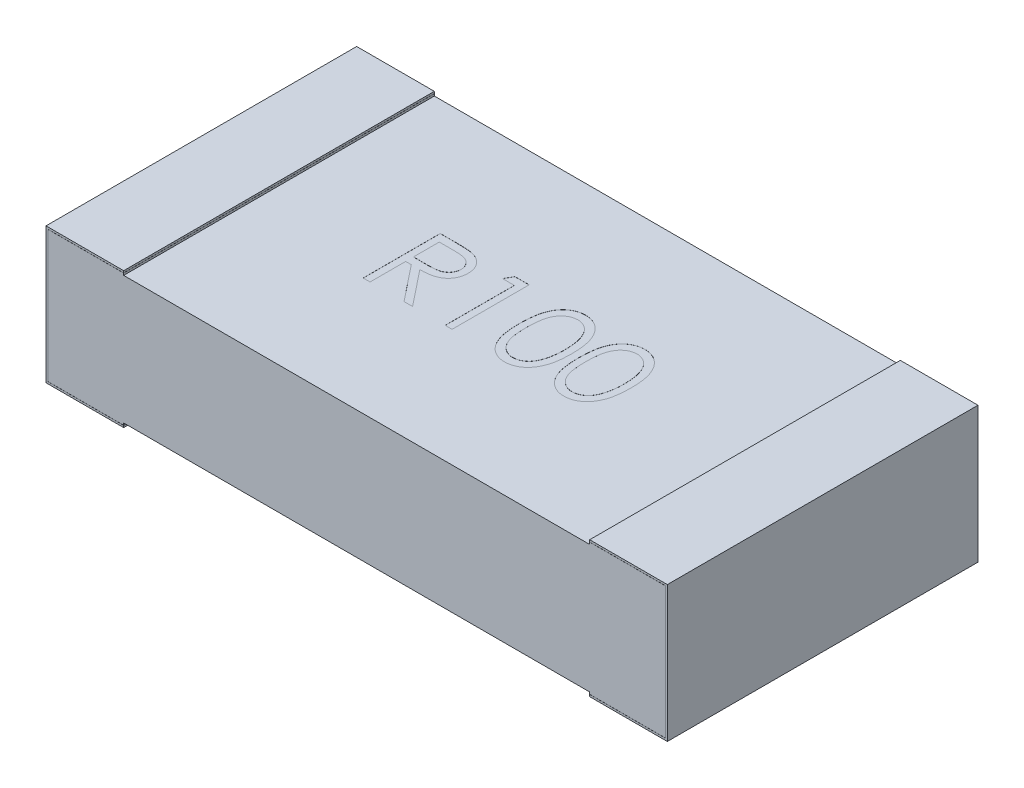
from build123d import *

# Parameters (mm, degrees)
SKETCH1_W           = 6.4
SKETCH1_H           = 3.2
BOSS_EXTRUDE1_DEPTH = 1.4
SKETCH2_W           = 4.8
SKETCH2_H           = 0.042
CUT_EXTRUDE1_DEPTH  = 8.291090453
CUT_EXTRUDE2_DEPTH  = 8.291090453
CUT_EXTRUDE3_DEPTH  = 0.001


with BuildPart() as part:
    # Sketch1 → Boss-Extrude1 (new body)
    with BuildSketch(Plane(origin=(0, 0, 0), x_dir=(1, 0, 0), z_dir=(0, 1, 0))):
        with Locations((3.2, 1.6)):
            Rectangle(SKETCH1_W, SKETCH1_H)
    extrude(amount=BOSS_EXTRUDE1_DEPTH)

    # Sketch2 → Cut-Extrude1 (cut, through all)
    with BuildSketch(Plane.XY):
        with Locations((3.2, 1.379)):
            Rectangle(SKETCH2_W, SKETCH2_H)
        with Locations((3.2, 0.021)):
            Rectangle(SKETCH2_W, SKETCH2_H)
    extrude(amount=-CUT_EXTRUDE1_DEPTH, mode=Mode.SUBTRACT)

    # Sketch5 → Cut-Extrude2 (cut, through all)
    with BuildSketch(Plane.XY):
        Polygon((0.02, 0.02), (0.8, 0.02), (0.8, 0.021), (0.021, 0.021), (0.021, 1.379), (0.8, 1.379), (0.8, 1.38), (0.02, 1.38), align=None)
        Polygon((6.379, 0.021), (5.6, 0.021), (5.6, 0.02), (6.38, 0.02), (6.38, 1.38), (5.6, 1.38), (5.6, 1.379), (6.379, 1.379), align=None)
    extrude(amount=-CUT_EXTRUDE2_DEPTH, mode=Mode.SUBTRACT)


with BuildPart() as cut_extrude2_piece_1:
    # of the separate pieces the step leaves, piece 1, a body of its own (cut_extrude2_pieces)
    add(part.part.solids().sort_by_distance((0.8, 0.042, 0))[0])

    # Sketch6 → Cut-Extrude3 (cut)
    # profile 1 of 4: a face of its own
    with BuildSketch(Plane(origin=(0, 1.358, 0), x_dir=(1, 0, 0), z_dir=(0, 1, 0))):
        with BuildLine():
            Line((2.056591687, 2.004217854), (2.21543709, 2.004217854))
            add(Edge.make_bspline(
                [(2.21543709, 2.004217854), (2.22603731, 2.004182569), (2.246390907, 2.004114819), (2.275549488, 2.003737048), (2.302044205, 2.002654292), (2.325861204, 2.001722524), (2.347000049, 2.000023459), (2.36552556, 1.998399526), (2.381352413, 1.996273714), (2.390933168, 1.994299448), (2.395271074, 1.993405554)],
                knots=[0, 0, 0, 0, 1.410062039, 2.707475311, 3.878576406, 4.937260626, 5.877586885, 6.699081471, 7.410979367, 8, 8, 8, 8], degree=3))
            add(Edge.make_bspline(
                [(2.395271074, 1.993405554), (2.401078291, 1.991970734), (2.41256884, 1.989131703), (2.429112873, 1.983131044), (2.444877729, 1.97618695), (2.459797921, 1.968030892), (2.473798717, 1.958602326), (2.487024476, 1.94806402), (2.499535215, 1.936473635), (2.510824978, 1.923538948), (2.521470084, 1.909968883), (2.530448219, 1.895294995), (2.538187617, 1.879950327), (2.544349502, 1.863778823), (2.549311114, 1.846937314), (2.552809565, 1.829273248), (2.554907602, 1.810867098), (2.555121202, 1.798312715), (2.555229508, 1.791946971)],
                knots=[0, 0, 0, 0, 1.027469482, 2.033020251, 3.019912614, 3.986113645, 4.951240523, 5.91722682, 6.890402269, 7.87763091, 8.8651537, 9.85103654, 10.82876324, 11.815024772, 12.821070561, 13.842952187, 14.906261191, 16, 16, 16, 16], degree=3))
            add(Edge.make_bspline(
                [(2.555229508, 1.791946971), (2.55489636, 1.781370795), (2.554246303, 1.760733937), (2.548185431, 1.730784416), (2.538257542, 1.702846839), (2.524577081, 1.676956384), (2.507155522, 1.65361772), (2.486217578, 1.633118456), (2.46175157, 1.615964404), (2.438975635, 1.604068857), (2.418856522, 1.596450466), (2.40229361, 1.591090077), (2.384226278, 1.586948524), (2.364827632, 1.58323828), (2.344016946, 1.580437092), (2.321844098, 1.578385454), (2.298293274, 1.577103196), (2.282114593, 1.576912242), (2.273791707, 1.576814008)],
                knots=[0, 0, 0, 0, 1.260483769, 2.459530307, 3.627416485, 4.787058657, 5.939039949, 7.08810263, 8.267026773, 9.491475466, 10.141966685, 10.831826277, 11.566392101, 12.351337768, 13.187381173, 14.07005841, 15.007169909, 16, 16, 16, 16], degree=3))
            Line((2.273791707, 1.576814008), (2.56540579, 1.210467854))
            Line((2.56540579, 1.210467854), (2.477317348, 1.210467854))
            Line((2.477317348, 1.210467854), (2.185703266, 1.576814008))
            Line((2.185703266, 1.576814008), (2.127825662, 1.576814008))
            Line((2.127825662, 1.576814008), (2.127825662, 1.210467854))
            Line((2.127825662, 1.210467854), (2.056591687, 1.210467854))
            Line((2.056591687, 1.210467854), (2.056591687, 2.004217854))
        make_face()
        with BuildLine():
            Line((2.127825662, 1.922807598), (2.127825662, 1.658224264))
            Line((2.127825662, 1.658224264), (2.27315569, 1.657111233))
            add(Edge.make_bspline(
                [(2.27315569, 1.657111233), (2.279941127, 1.657108232), (2.293093238, 1.657102413), (2.31212071, 1.658008145), (2.329837235, 1.659038504), (2.346175048, 1.660614516), (2.361141449, 1.662645626), (2.374728955, 1.665186302), (2.386959747, 1.668146324), (2.401224237, 1.672727764), (2.417152879, 1.679986272), (2.434463763, 1.690546661), (2.449205365, 1.703829301), (2.461659952, 1.719017924), (2.471667876, 1.735717573), (2.478723646, 1.753728071), (2.48320095, 1.772594737), (2.483729031, 1.785561915), (2.483995534, 1.792105975)],
                knots=[0, 0, 0, 0, 1.146690395, 2.22261258, 3.21895312, 4.145990853, 4.996080663, 5.770904154, 6.481378293, 7.121626537, 8.300444488, 9.431385265, 10.535395872, 11.636531494, 12.74115979, 13.810798291, 14.895190096, 16, 16, 16, 16], degree=3))
            add(Edge.make_bspline(
                [(2.483995534, 1.792105975), (2.48372291, 1.798489216), (2.483182669, 1.81113847), (2.478771966, 1.829656864), (2.471313124, 1.847134547), (2.461261474, 1.863500422), (2.449015237, 1.878356187), (2.434655661, 1.89106688), (2.418575376, 1.901555598), (2.403546015, 1.908258109), (2.390112542, 1.912367433), (2.378449029, 1.915259215), (2.365270176, 1.917582514), (2.350511992, 1.919443985), (2.334237479, 1.921043946), (2.31636435, 1.922121581), (2.297011187, 1.922759726), (2.283597508, 1.922791269), (2.276653787, 1.922807598)],
                knots=[0, 0, 0, 0, 1.101028733, 2.181837193, 3.264309656, 4.369019818, 5.486613113, 6.575447106, 7.666700264, 8.788928104, 9.402425223, 10.0903467, 10.862060571, 11.710948788, 12.657782767, 13.684531032, 14.801375019, 16, 16, 16, 16], degree=3))
            Line((2.276653787, 1.922807598), (2.127825662, 1.922807598))
        make_face(mode=Mode.SUBTRACT)
    # profile 2 of 4: a face of its own
    with BuildSketch(Plane(origin=(0, 1.358, 0), x_dir=(1, 0, 0), z_dir=(0, 1, 0))):
        Polygon((2.825696004, 2.004217854), (2.972457072, 2.004217854), (2.972457072, 1.210467854), (2.901223098, 1.210467854), (2.901223098, 1.922807598), (2.779107713, 1.922807598), align=None)
    # profile 3 of 4: a face of its own
    with BuildSketch(Plane(origin=(0, 1.358, 0), x_dir=(1, 0, 0), z_dir=(0, 1, 0))):
        with BuildLine():
            add(Edge.make_bspline(
                [(3.267569252, 1.607024845), (3.267643641, 1.619746931), (3.267788145, 1.644459767), (3.269395697, 1.680469856), (3.272066177, 1.714251921), (3.275725902, 1.745807581), (3.280179516, 1.775144981), (3.286124814, 1.80218572), (3.292885931, 1.827054953), (3.300721932, 1.849833774), (3.309563806, 1.870829075), (3.31918729, 1.890429076), (3.329974306, 1.908604121), (3.341308356, 1.925644299), (3.353648236, 1.941270672), (3.366642784, 1.955703919), (3.380799173, 1.968610464), (3.395636177, 1.980368465), (3.411288125, 1.990675756), (3.427308873, 1.999754609), (3.443808691, 2.00751065), (3.460832629, 2.013609017), (3.478227674, 2.01864612), (3.496054633, 2.022090756), (3.514342943, 2.024258127), (3.526687215, 2.024465333), (3.532947607, 2.024570418)],
                knots=[0, 0, 0, 0, 1.646270934, 3.197905019, 4.663502075, 6.030701355, 7.308322542, 8.50163776, 9.611534131, 10.641858119, 11.616356847, 12.558055219, 13.465016945, 14.349605745, 15.204443733, 16.039544428, 16.859896111, 17.680448484, 18.487036065, 19.28249412, 20.06191084, 20.843045899, 21.620316918, 22.403196591, 23.190181807, 24, 24, 24, 24], degree=3))
            add(Edge.make_bspline(
                [(3.532947607, 2.024570418), (3.539260296, 2.024459789), (3.551814248, 2.024239781), (3.570374476, 2.022125244), (3.588505921, 2.018616615), (3.606131285, 2.013645251), (3.623395344, 2.00747766), (3.640163065, 1.999747189), (3.6565386, 1.990748588), (3.672261719, 1.980174959), (3.687505033, 1.968386121), (3.701894125, 1.955059588), (3.715430303, 1.940329919), (3.728283453, 1.924354711), (3.740088919, 1.906827558), (3.751331465, 1.888053304), (3.761394409, 1.867703626), (3.771086023, 1.846118055), (3.779451464, 1.822699333), (3.786995774, 1.797579467), (3.79309154, 1.77046175), (3.798169107, 1.741488459), (3.802102681, 1.71055319), (3.804967584, 1.677722258), (3.806480944, 1.642974062), (3.806765946, 1.619216479), (3.8069122, 1.607024845)],
                knots=[0, 0, 0, 0, 0.810914788, 1.612654377, 2.396697861, 3.181598691, 3.963628158, 4.749916497, 5.551656086, 6.361998678, 7.18212741, 8.025565596, 8.878627764, 9.750805457, 10.657531673, 11.591944965, 12.560506719, 13.57287815, 14.630710178, 15.753379473, 16.941251878, 18.199788006, 19.531962791, 20.947069417, 22.433333509, 24, 24, 24, 24], degree=3))
            add(Edge.make_bspline(
                [(3.8069122, 1.607024845), (3.80676443, 1.594886388), (3.806476506, 1.571235098), (3.80498455, 1.536643252), (3.802045717, 1.503986552), (3.798369523, 1.47318668), (3.793277966, 1.444371827), (3.787017508, 1.417442282), (3.780066453, 1.392281752), (3.771486062, 1.369096357), (3.762094705, 1.347562663), (3.75187683, 1.32745422), (3.740929923, 1.308593293), (3.729003547, 1.29113085), (3.716291433, 1.274943191), (3.702521506, 1.260316051), (3.688081927, 1.246896988), (3.672793754, 1.234956351), (3.65682542, 1.224504976), (3.64050613, 1.215158263), (3.623546327, 1.207621563), (3.606330353, 1.201150223), (3.588611956, 1.196206192), (3.570413221, 1.192787657), (3.551826718, 1.190390113), (3.539262434, 1.190207215), (3.532947607, 1.19011529)],
                knots=[0, 0, 0, 0, 1.561518951, 3.042555995, 4.452378317, 5.7783523, 7.031515105, 8.214008947, 9.334062868, 10.386615937, 11.391082383, 12.354592575, 13.286541444, 14.194233754, 15.072674879, 15.931287219, 16.775624067, 17.606195743, 18.42308326, 19.229000347, 20.022332153, 20.807536673, 21.593273796, 22.3848459, 23.188221202, 24, 24, 24, 24], degree=3))
            add(Edge.make_bspline(
                [(3.532947607, 1.19011529), (3.526687388, 1.190221053), (3.514343459, 1.190429596), (3.496052641, 1.192587175), (3.478299301, 1.196055976), (3.460995834, 1.200912956), (3.444053463, 1.206858106), (3.427703055, 1.214603674), (3.411762813, 1.223524079), (3.396275264, 1.233683041), (3.381531434, 1.245322065), (3.367448358, 1.258195395), (3.354379826, 1.272624276), (3.34221638, 1.288380876), (3.330656185, 1.305320236), (3.320022345, 1.323673635), (3.310186455, 1.343368299), (3.301195877, 1.364531468), (3.293224663, 1.38747196), (3.286183486, 1.41245222), (3.280624025, 1.439692731), (3.275865391, 1.468974705), (3.272027182, 1.500423972), (3.269406826, 1.534057603), (3.267787278, 1.569854642), (3.267643253, 1.59440868), (3.267569252, 1.607024845)],
                knots=[0, 0, 0, 0, 0.810891512, 1.598919785, 2.382837074, 3.152667961, 3.926044502, 4.706494248, 5.493654104, 6.291793342, 7.103789334, 7.925228297, 8.761435821, 9.622817696, 10.50288917, 11.416980706, 12.369136599, 13.353924996, 14.394355917, 15.514179734, 16.714354668, 17.994756427, 19.357759367, 20.818452758, 22.365282078, 24, 24, 24, 24], degree=3))
        make_face()
        with BuildLine():
            add(Edge.make_bspline(
                [(3.338803226, 1.607342854), (3.338830315, 1.596740917), (3.338882889, 1.576164639), (3.340256349, 1.546264471), (3.342127384, 1.518376557), (3.344540678, 1.492465487), (3.348124561, 1.468618966), (3.352140207, 1.446672985), (3.357027006, 1.426743683), (3.362808912, 1.408694304), (3.369394564, 1.392218533), (3.376585001, 1.376887544), (3.384309487, 1.362520229), (3.392954365, 1.349245643), (3.402369389, 1.337020495), (3.412341896, 1.325628407), (3.423244071, 1.315469091), (3.43832617, 1.303284608), (3.458237156, 1.290693662), (3.483324295, 1.279729459), (3.509102676, 1.272839152), (3.526599477, 1.271962907), (3.535332673, 1.271525546)],
                knots=[0, 0, 0, 0, 1.459021318, 2.831673884, 4.118529203, 5.306027144, 6.411944654, 7.436330062, 8.375795394, 9.233974572, 10.042671642, 10.816086306, 11.563610507, 12.285937304, 12.993564865, 13.685989202, 14.367179055, 15.041617293, 16.353048772, 17.594441528, 18.799311195, 20, 20, 20, 20], degree=3))
            add(Edge.make_bspline(
                [(3.535332673, 1.271525546), (3.544122359, 1.2718879), (3.561683584, 1.27261186), (3.587340713, 1.279596574), (3.612248649, 1.290135201), (3.631768536, 1.30259651), (3.646619041, 1.314463828), (3.657259144, 1.324581793), (3.667025002, 1.33591107), (3.676287401, 1.34813466), (3.684782584, 1.361486099), (3.692507617, 1.375901183), (3.699556876, 1.391419943), (3.703573035, 1.402253437), (3.705626393, 1.407792323)],
                knots=[0, 0, 0, 0, 1.353760809, 2.704726607, 4.075137775, 5.516104923, 6.260822281, 7.007110065, 7.778089737, 8.566572457, 9.372053459, 10.217411131, 11.088608312, 12, 12, 12, 12], degree=3))
            add(Edge.make_bspline(
                [(3.705626393, 1.407792323), (3.708019383, 1.414874782), (3.712878179, 1.429255211), (3.719140135, 1.451562682), (3.724071681, 1.474967594), (3.728508373, 1.499330076), (3.731536656, 1.524829794), (3.733974106, 1.551387849), (3.735409815, 1.579024265), (3.735587786, 1.597800986), (3.735678226, 1.607342854)],
                knots=[0, 0, 0, 0, 0.884706709, 1.796334032, 2.740027952, 3.714592787, 4.726048262, 5.777819803, 6.87074269, 8, 8, 8, 8], degree=3))
            add(Edge.make_bspline(
                [(3.735678226, 1.607342854), (3.735553451, 1.616883179), (3.735309364, 1.635546093), (3.73437637, 1.662877894), (3.731967096, 1.688837547), (3.729291224, 1.713536887), (3.725345783, 1.736839187), (3.72109178, 1.758939525), (3.715376505, 1.779564103), (3.709271485, 1.79903583), (3.702284127, 1.817133478), (3.694592523, 1.833941426), (3.686377946, 1.849540819), (3.677455688, 1.863888858), (3.667931667, 1.87704981), (3.657554508, 1.888759798), (3.646735838, 1.899381753), (3.631582655, 1.9115063), (3.611744735, 1.923868774), (3.587060098, 1.935245652), (3.561371934, 1.941778961), (3.544006168, 1.942700093), (3.535332673, 1.943160162)],
                knots=[0, 0, 0, 0, 1.31362396, 2.569729283, 3.763502607, 4.902122613, 5.988968491, 7.01645872, 7.998833611, 8.933434873, 9.825090667, 10.667526885, 11.477055099, 12.250526234, 12.991942729, 13.710640831, 14.402115721, 15.076753259, 16.378508321, 17.609869233, 18.806226677, 20, 20, 20, 20], degree=3))
            add(Edge.make_bspline(
                [(3.535332673, 1.943160162), (3.526553664, 1.942699459), (3.508979652, 1.941777213), (3.483024491, 1.935269993), (3.458145111, 1.923927767), (3.438359651, 1.911465354), (3.423195899, 1.899595773), (3.412518217, 1.889302773), (3.402506496, 1.878043712), (3.393283642, 1.865706135), (3.384645537, 1.852447025), (3.376712343, 1.838162073), (3.369564663, 1.822778888), (3.362968706, 1.806310518), (3.357169163, 1.788262697), (3.352385353, 1.768357943), (3.347965968, 1.746481764), (3.344837398, 1.72250609), (3.342056153, 1.69658853), (3.340268776, 1.668630995), (3.338878295, 1.638680681), (3.33882875, 1.617998014), (3.338803226, 1.607342854)],
                knots=[0, 0, 0, 0, 1.207732386, 2.417664972, 3.655092373, 4.956220595, 5.625982001, 6.301752483, 6.994047911, 7.697131622, 8.419323945, 9.170223765, 9.943494443, 10.752040957, 11.610060368, 12.549350801, 13.567764191, 14.679664412, 15.874934091, 17.154273443, 18.533957287, 20, 20, 20, 20], degree=3))
        make_face(mode=Mode.SUBTRACT)
    # profile 4 of 4: a face of its own
    with BuildSketch(Plane(origin=(0, 1.358, 0), x_dir=(1, 0, 0), z_dir=(0, 1, 0))):
        with BuildLine():
            add(Edge.make_bspline(
                [(3.878146175, 1.607024845), (3.878220564, 1.619746931), (3.878365068, 1.644459767), (3.87997262, 1.680469856), (3.8826431, 1.714251921), (3.886302825, 1.745807581), (3.890756439, 1.775144981), (3.896701737, 1.80218572), (3.903462854, 1.827054953), (3.911298855, 1.849833774), (3.920140729, 1.870829075), (3.929764213, 1.890429076), (3.940551229, 1.908604121), (3.951885279, 1.925644299), (3.964225159, 1.941270672), (3.977219707, 1.955703919), (3.991376096, 1.968610464), (4.0062131, 1.980368465), (4.021865048, 1.990675756), (4.037885796, 1.999754609), (4.054385614, 2.00751065), (4.071409552, 2.013609017), (4.088804597, 2.01864612), (4.106631556, 2.022090756), (4.124919866, 2.024258127), (4.137264138, 2.024465333), (4.14352453, 2.024570418)],
                knots=[0, 0, 0, 0, 1.646270934, 3.197905019, 4.663502075, 6.030701355, 7.308322542, 8.50163776, 9.611534131, 10.641858119, 11.616356847, 12.558055219, 13.465016945, 14.349605745, 15.204443733, 16.039544428, 16.859896111, 17.680448484, 18.487036065, 19.28249412, 20.06191084, 20.843045899, 21.620316918, 22.403196591, 23.190181807, 24, 24, 24, 24], degree=3))
            add(Edge.make_bspline(
                [(4.14352453, 2.024570418), (4.149837219, 2.024459789), (4.162391171, 2.024239781), (4.180951399, 2.022125244), (4.199082844, 2.018616615), (4.216708208, 2.013645251), (4.233972268, 2.00747766), (4.250739989, 1.999747189), (4.267115523, 1.990748588), (4.282838642, 1.980174959), (4.298081956, 1.968386121), (4.312471048, 1.955059588), (4.326007226, 1.940329919), (4.338860376, 1.924354711), (4.350665842, 1.906827558), (4.361908388, 1.888053304), (4.371971332, 1.867703626), (4.381662946, 1.846118055), (4.390028387, 1.822699333), (4.397572697, 1.797579467), (4.403668463, 1.77046175), (4.40874603, 1.741488459), (4.412679604, 1.71055319), (4.415544507, 1.677722258), (4.417057868, 1.642974062), (4.417342869, 1.619216479), (4.417489123, 1.607024845)],
                knots=[0, 0, 0, 0, 0.810914788, 1.612654377, 2.396697861, 3.181598691, 3.963628158, 4.749916497, 5.551656086, 6.361998678, 7.18212741, 8.025565596, 8.878627764, 9.750805457, 10.657531673, 11.591944965, 12.560506719, 13.57287815, 14.630710178, 15.753379473, 16.941251878, 18.199788006, 19.531962791, 20.947069417, 22.433333509, 24, 24, 24, 24], degree=3))
            add(Edge.make_bspline(
                [(4.417489123, 1.607024845), (4.417341353, 1.594886388), (4.417053429, 1.571235098), (4.415561473, 1.536643252), (4.41262264, 1.503986552), (4.408946446, 1.47318668), (4.403854889, 1.444371827), (4.397594431, 1.417442282), (4.390643376, 1.392281752), (4.382062985, 1.369096357), (4.372671628, 1.347562663), (4.362453753, 1.32745422), (4.351506846, 1.308593293), (4.33958047, 1.29113085), (4.326868356, 1.274943191), (4.313098429, 1.260316051), (4.29865885, 1.246896988), (4.283370677, 1.234956351), (4.267402343, 1.224504976), (4.251083053, 1.215158263), (4.23412325, 1.207621563), (4.216907276, 1.201150223), (4.199188879, 1.196206192), (4.180990144, 1.192787657), (4.162403641, 1.190390113), (4.149839357, 1.190207215), (4.14352453, 1.19011529)],
                knots=[0, 0, 0, 0, 1.561518951, 3.042555995, 4.452378317, 5.7783523, 7.031515105, 8.214008947, 9.334062868, 10.386615937, 11.391082383, 12.354592575, 13.286541444, 14.194233754, 15.072674879, 15.931287219, 16.775624067, 17.606195743, 18.42308326, 19.229000347, 20.022332153, 20.807536673, 21.593273796, 22.3848459, 23.188221202, 24, 24, 24, 24], degree=3))
            add(Edge.make_bspline(
                [(4.14352453, 1.19011529), (4.137264311, 1.190221053), (4.124920382, 1.190429596), (4.106629564, 1.192587175), (4.088876224, 1.196055976), (4.071572757, 1.200912956), (4.054630386, 1.206858106), (4.038279978, 1.214603674), (4.022339736, 1.223524079), (4.006852187, 1.233683041), (3.992108357, 1.245322065), (3.978025281, 1.258195395), (3.96495675, 1.272624276), (3.952793303, 1.288380876), (3.941233108, 1.305320236), (3.930599268, 1.323673635), (3.920763378, 1.343368299), (3.9117728, 1.364531468), (3.903801586, 1.38747196), (3.896760409, 1.41245222), (3.891200948, 1.439692731), (3.886442314, 1.468974705), (3.882604105, 1.500423972), (3.879983749, 1.534057603), (3.878364201, 1.569854642), (3.878220176, 1.59440868), (3.878146175, 1.607024845)],
                knots=[0, 0, 0, 0, 0.810891512, 1.598919785, 2.382837074, 3.152667961, 3.926044502, 4.706494248, 5.493654104, 6.291793342, 7.103789334, 7.925228297, 8.761435821, 9.622817696, 10.50288917, 11.416980706, 12.369136599, 13.353924996, 14.394355917, 15.514179734, 16.714354668, 17.994756427, 19.357759367, 20.818452758, 22.365282078, 24, 24, 24, 24], degree=3))
        make_face()
        with BuildLine():
            add(Edge.make_bspline(
                [(3.949380149, 1.607342854), (3.949407238, 1.596740917), (3.949459812, 1.576164639), (3.950833272, 1.546264471), (3.952704307, 1.518376557), (3.955117601, 1.492465487), (3.958701484, 1.468618966), (3.96271713, 1.446672985), (3.967603929, 1.426743683), (3.973385835, 1.408694304), (3.979971487, 1.392218533), (3.987161924, 1.376887544), (3.99488641, 1.362520229), (4.003531288, 1.349245643), (4.012946312, 1.337020495), (4.022918819, 1.325628407), (4.033820994, 1.315469091), (4.048903093, 1.303284608), (4.068814079, 1.290693662), (4.093901218, 1.279729459), (4.119679599, 1.272839152), (4.1371764, 1.271962907), (4.145909596, 1.271525546)],
                knots=[0, 0, 0, 0, 1.459021318, 2.831673884, 4.118529203, 5.306027144, 6.411944654, 7.436330062, 8.375795394, 9.233974572, 10.042671642, 10.816086306, 11.563610507, 12.285937304, 12.993564865, 13.685989202, 14.367179055, 15.041617293, 16.353048772, 17.594441528, 18.799311195, 20, 20, 20, 20], degree=3))
            add(Edge.make_bspline(
                [(4.145909596, 1.271525546), (4.154699282, 1.2718879), (4.172260507, 1.27261186), (4.197917636, 1.279596574), (4.222825572, 1.290135201), (4.242345459, 1.30259651), (4.257195964, 1.314463828), (4.267836067, 1.324581793), (4.277601925, 1.33591107), (4.286864324, 1.34813466), (4.295359507, 1.361486099), (4.30308454, 1.375901183), (4.310133799, 1.391419943), (4.314149958, 1.402253437), (4.316203316, 1.407792323)],
                knots=[0, 0, 0, 0, 1.353760809, 2.704726607, 4.075137775, 5.516104923, 6.260822281, 7.007110065, 7.778089737, 8.566572457, 9.372053459, 10.217411131, 11.088608312, 12, 12, 12, 12], degree=3))
            add(Edge.make_bspline(
                [(4.316203316, 1.407792323), (4.318596306, 1.414874782), (4.323455103, 1.429255211), (4.329717059, 1.451562682), (4.334648604, 1.474967594), (4.339085296, 1.499330076), (4.342113579, 1.524829794), (4.344551029, 1.551387849), (4.345986738, 1.579024265), (4.346164709, 1.597800986), (4.346255149, 1.607342854)],
                knots=[0, 0, 0, 0, 0.884706709, 1.796334032, 2.740027952, 3.714592787, 4.726048262, 5.777819803, 6.87074269, 8, 8, 8, 8], degree=3))
            add(Edge.make_bspline(
                [(4.346255149, 1.607342854), (4.346130374, 1.616883179), (4.345886287, 1.635546093), (4.344953294, 1.662877894), (4.342544019, 1.688837547), (4.339868147, 1.713536887), (4.335922706, 1.736839187), (4.331668703, 1.758939525), (4.325953428, 1.779564103), (4.319848408, 1.79903583), (4.31286105, 1.817133478), (4.305169446, 1.833941426), (4.296954869, 1.849540819), (4.288032611, 1.863888858), (4.27850859, 1.87704981), (4.268131431, 1.888759798), (4.257312761, 1.899381753), (4.242159578, 1.9115063), (4.222321659, 1.923868774), (4.197637021, 1.935245652), (4.171948857, 1.941778961), (4.154583091, 1.942700093), (4.145909596, 1.943160162)],
                knots=[0, 0, 0, 0, 1.31362396, 2.569729283, 3.763502607, 4.902122613, 5.988968491, 7.01645872, 7.998833611, 8.933434873, 9.825090667, 10.667526885, 11.477055099, 12.250526234, 12.991942729, 13.710640831, 14.402115721, 15.076753259, 16.378508321, 17.609869233, 18.806226677, 20, 20, 20, 20], degree=3))
            add(Edge.make_bspline(
                [(4.145909596, 1.943160162), (4.137130587, 1.942699459), (4.119556575, 1.941777213), (4.093601414, 1.935269993), (4.068722034, 1.923927767), (4.048936574, 1.911465354), (4.033772822, 1.899595773), (4.02309514, 1.889302773), (4.013083419, 1.878043712), (4.003860565, 1.865706135), (3.99522246, 1.852447025), (3.987289266, 1.838162073), (3.980141586, 1.822778888), (3.973545629, 1.806310518), (3.967746086, 1.788262697), (3.962962276, 1.768357943), (3.958542891, 1.746481764), (3.955414321, 1.72250609), (3.952633076, 1.69658853), (3.950845699, 1.668630995), (3.949455218, 1.638680681), (3.949405673, 1.617998014), (3.949380149, 1.607342854)],
                knots=[0, 0, 0, 0, 1.207732386, 2.417664972, 3.655092373, 4.956220595, 5.625982001, 6.301752483, 6.994047911, 7.697131622, 8.419323945, 9.170223765, 9.943494443, 10.752040957, 11.610060368, 12.549350801, 13.567764191, 14.679664412, 15.874934091, 17.154273443, 18.533957287, 20, 20, 20, 20], degree=3))
        make_face(mode=Mode.SUBTRACT)
    extrude(amount=-CUT_EXTRUDE3_DEPTH, mode=Mode.SUBTRACT)


with BuildPart() as cut_extrude2_piece_2:
    # of the separate pieces the step leaves, piece 2, a body of its own (cut_extrude2_pieces)
    add(part.part.solids().sort_by_distance((0, 0, 0))[0])


with BuildPart() as cut_extrude2_piece_3:
    # of the separate pieces the step leaves, piece 3, a body of its own (cut_extrude2_pieces)
    add(part.part.solids().sort_by_distance((5.6, 0, 0))[0])


solid = Compound([cut_extrude2_piece_1.part, cut_extrude2_piece_2.part, cut_extrude2_piece_3.part])
